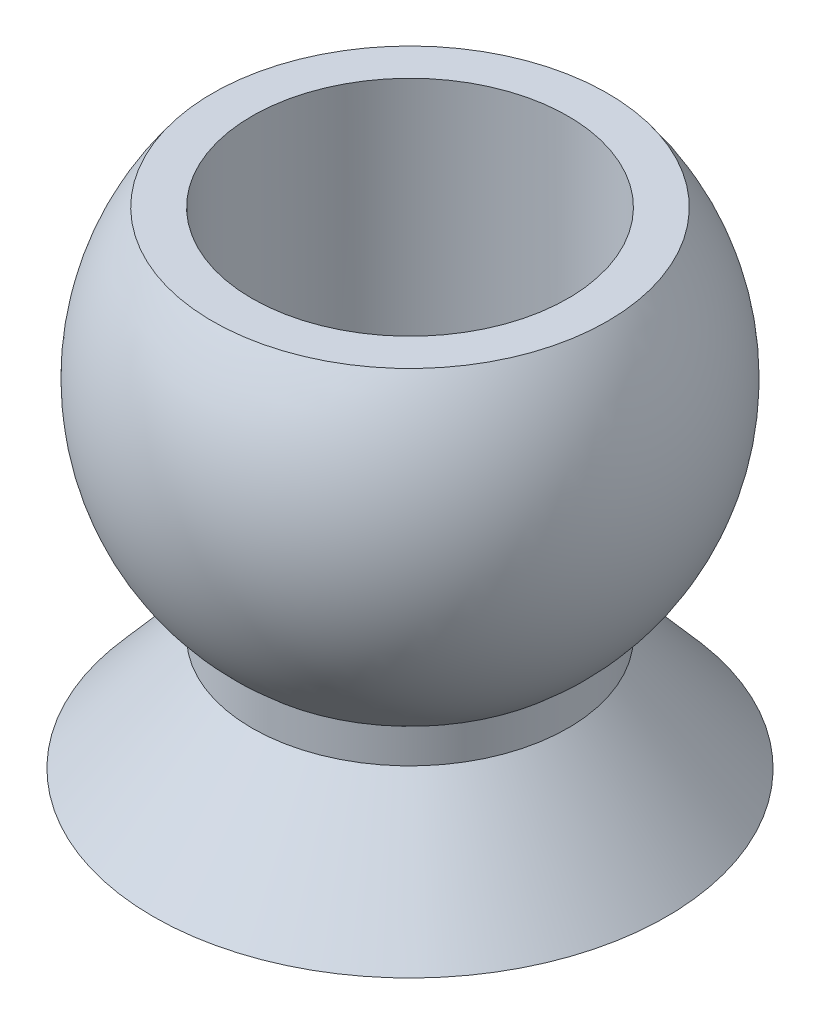
from build123d import *

# Parameters (mm, degrees)
SKETCH_2_R          = 1.037641751
CUT_EXTRUDE_1_DEPTH = 10
SKETCH_3_R          = 0.8
CUT_EXTRUDE_2_DEPTH = 10


with BuildPart() as part:
    # 草图1 → 旋转1 (revolve)
    with BuildSketch(Plane.XY):
        with BuildLine():
            Line((0, 1.25), (0, -1.25))
            ThreePointArc((0, -1.25), (1.25, 0), (0, 1.25))
        make_face()
    revolve(axis=Axis((0, 1.25, 0), (0, -1, 0)))

    # 草图2 → 切除-拉伸1 (cut)
    with BuildSketch(Plane(origin=(0, 0.75, 0), x_dir=(1, 0, 0), z_dir=(0, 1, 0))):
        Circle(SKETCH_2_R)
    extrude(amount=CUT_EXTRUDE_1_DEPTH, mode=Mode.SUBTRACT)

    # 草图3 → 切除-拉伸2 (cut)
    with BuildSketch(Plane(origin=(0, 0.75, 0), x_dir=(1, 0, 0), z_dir=(0, 1, 0))):
        with Locations(Location((0, 0, 0), (0, 0, 270))):
            Circle(SKETCH_3_R)
    extrude(amount=-CUT_EXTRUDE_2_DEPTH, mode=Mode.SUBTRACT)


with BuildPart() as body_2:
    # 草图4 → 旋转3 (revolve)
    with BuildSketch(Plane(origin=(0, 0, 0), x_dir=(0, 0, -1), z_dir=(1, 0, 0)), mode=Mode.PRIVATE) as revolve_3_sk:
        Polygon((0, -0.960468636), (0, -1.710468636), (1.3, -1.710468636), (0.8, -1.134005887), (0.8, -0.960468636), align=None)
    revolve(revolve_3_sk.sketch.rotate(Axis((0, -0.960468636, 0), (0, -1, 0)), 180), axis=Axis((0, -0.960468636, 0), (0, -1, 0)))


solid = Compound([part.part, body_2.part])
